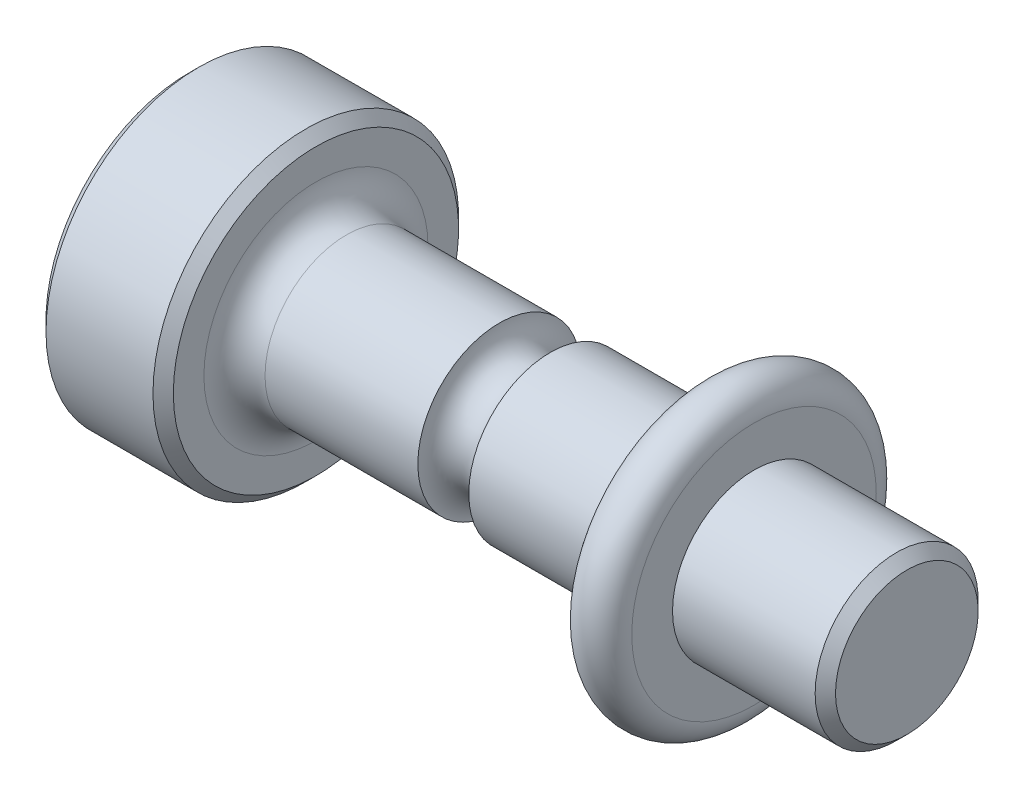
from build123d import *

# Parameters (mm, degrees)
CHAMFER1_SIZE = 2


with BuildPart() as part:
    # Sketch1 → Revolve1 (revolve)
    with BuildSketch(Plane.XY, mode=Mode.PRIVATE) as revolve1_sk:
        with BuildLine():
            Line((0, 0), (141, 0))
            Line((141, 0), (141, 16))
            Line((141, 16), (111, 16))
            Line((111, 16), (111, 24))
            ThreePointArc((111, 24), (106, 29), (101, 24))
            Line((101, 24), (101, 16))
            Line((101, 16), (71, 16))
            ThreePointArc((71, 16), (66, 11), (61, 16))
            Line((61, 16), (31, 16))
            ThreePointArc((31, 16), (26.757359313, 17.757359313), (25, 22))
            Line((25, 22), (25, 30))
            Line((25, 30), (0, 30))
            Line((0, 30), (0, 0))
        make_face()
    revolve(revolve1_sk.sketch.rotate(Axis((-31.320754717, 0, 0), (1, 0, 0)), 90), axis=Axis((-31.320754717, 0, 0), (1, 0, 0)))

    # Chamfer1
    chamfer1_edges = [part.edges().sort_by_distance(p)[0] for p in [
        (141, 0, -16),
        (25, 0, -30),
        (0, 0, -30),
    ]]
    chamfer(chamfer1_edges, length=CHAMFER1_SIZE)


solid = part.part
